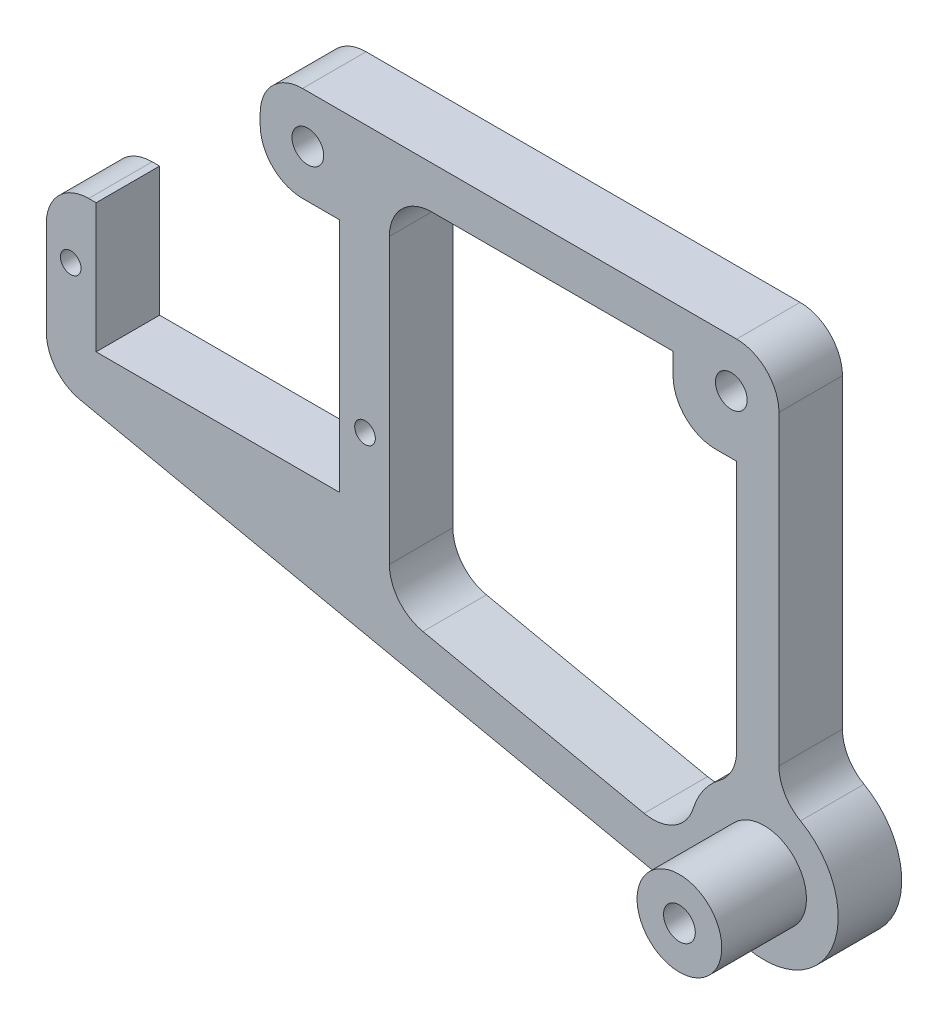
from build123d import *

# Parameters (mm, degrees)
BOSS_EXTRUDE1_DEPTH      = 6
MOUNT_SCREW_HOLES_REACH  = 65.711
SKETCH12_R               = 1.5
GEAR_START               = 6
SKETCH13_R               = 4
GEAR_SHAFT_DEPTH         = 8
SKETCH14_R               = 1.5
GEAR_SCREW_HOLE_DEPTH    = 65.954522552
SKETCH15_R               = 0.975
SERVO_SCREW_CUTOUT_DEPTH = 65.954522552
FILLET1_R                = 4


with BuildPart() as part:
    # body → Boss-Extrude1 (new body)
    with BuildSketch(Plane.XY):
        with BuildLine():
            Line((-24.5, 4.5), (24.5, 4.5))
            Line((24.5, 4.5), (24.5, -31.14142872))
            ThreePointArc((24.5, -31.14142872), (29.953423421, -39.424986813), (21.650045301, -44.848184531))
            Line((21.650045301, -44.848184531), (-44.7, -30.8))
            Line((-44.7, -30.8), (-44.7, -14.6))
            Line((-44.7, -14.6), (-40, -14.6))
            Line((-40, -14.6), (-40, -26.8))
            Line((-40, -26.8), (-17, -26.8))
            Line((-17, -26.8), (-17, -4.5))
            Line((-17, -4.5), (-24.5, -4.5))
            Line((-24.5, -4.5), (-24.5, 4.5))
        make_face()
        with BuildLine():
            Line((-12.3, 0.5), (14.5, 0.5))
            Line((14.5, 0.5), (14.5, -5.5))
            Line((14.5, -5.5), (20.5, -5.5))
            Line((20.5, -5.5), (20.5, -31.500769276))
            ThreePointArc((20.5, -31.500769276), (16.884558972, -34.780016642), (16.291201999, -39.624890698))
            Line((16.291201999, -39.624890698), (-12.3, -33.571323141))
            Line((-12.3, -33.571323141), (-12.3, 0.5))
        make_face(mode=Mode.SUBTRACT)
    extrude(amount=BOSS_EXTRUDE1_DEPTH)

    # Sketch12 → mount screw holes (cut, up to next)
    with BuildSketch(Plane.XY, mode=Mode.PRIVATE) as mount_screw_holes_sk1:
        with Locations(Location((20, 0, 0), (0, 0, 180))):
            Circle(SKETCH12_R)
    mount_screw_holes_tool1 = extrude(mount_screw_holes_sk1.sketch, amount=MOUNT_SCREW_HOLES_REACH, mode=Mode.PRIVATE) & part.part
    # Sketch12 → mount screw holes (cut, up to next)
    with BuildSketch(Plane.XY, mode=Mode.PRIVATE) as mount_screw_holes_sk2:
        with Locations(Location((-20, 0, 0), (0, 0, 180))):
            Circle(SKETCH12_R)
    mount_screw_holes_tool2 = extrude(mount_screw_holes_sk2.sketch, amount=MOUNT_SCREW_HOLES_REACH, mode=Mode.PRIVATE) & part.part
    add(mount_screw_holes_tool1.solids().sort_by_distance((20, 0, 0))[0], mode=Mode.SUBTRACT)
    add(mount_screw_holes_tool2.solids().sort_by_distance((-20, 0, 0))[0], mode=Mode.SUBTRACT)

    # Sketch13 → gear shaft (add)
    with BuildSketch(Plane.XY.offset(GEAR_START)):
        with Locations((23.1, -38)):
            Circle(SKETCH13_R)
    extrude(amount=GEAR_SHAFT_DEPTH)

    # Sketch14 → gear screw hole (cut, through all)
    with BuildSketch(Plane.XY):
        with Locations((23.1, -38)):
            Circle(SKETCH14_R)
    extrude(amount=GEAR_SCREW_HOLE_DEPTH, mode=Mode.SUBTRACT)

    # Sketch15 → servo screw cutout (cut, through all)
    with BuildSketch(Plane.XY):
        with Locations((-14.6, -20.7)):
            Circle(SKETCH15_R)
        with Locations((-42.4, -20.7)):
            Circle(SKETCH15_R)
    extrude(amount=SERVO_SCREW_CUTOUT_DEPTH, mode=Mode.SUBTRACT)

    # Fillet1
    fillet1_edges = [part.edges().sort_by_distance(p)[0] for p in [
        (-24.5, -4.5, 3),
        (-24.5, 4.5, 3),
        (24.5, 4.5, 3),
        (24.5, -31.14142872, 3),
        (-44.7, -30.8, 3),
        (-44.7, -14.6, 3),
        (14.5, -5.5, 3),
        (-12.3, 0.5, 3),
        (-12.3, -33.571323141, 3),
        (16.291201999, -39.624890698, 3),
        (20.5, -31.500769276, 3),
    ]]
    fillet(fillet1_edges, radius=FILLET1_R)


solid = part.part
